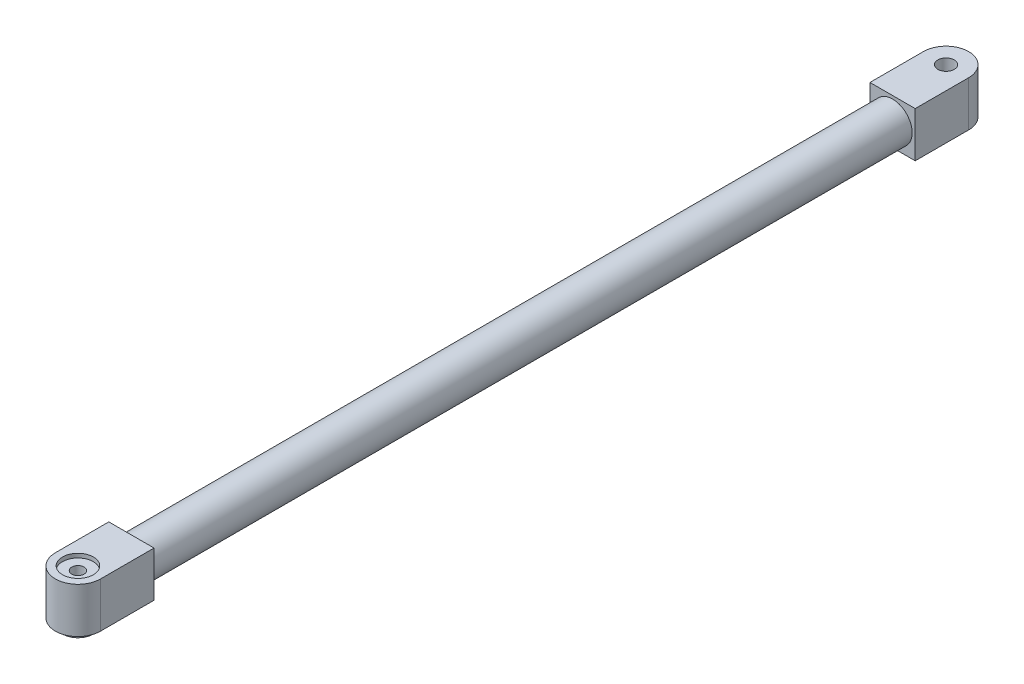
from build123d import *

# Parameters (mm, degrees)
SKETCH1_R                = 9.525
SKETCH1_R_2              = 6.2738
BOSS_EXTRUDE1_DEPTH      = 400
SKETCH2_W                = 22
SKETCH2_H                = 22
SKETCH2_R                = 9.525
BOSS_EXTRUDE2_DEPTH      = 15
SKETCH2_2_W              = 22
SKETCH2_2_H              = 22
BOSS_EXTRUDE3_DEPTH      = 2
SKETCH3_R                = 4
BOSS_EXTRUDE4_DEPTH      = 22
SKETCH4_R                = 7.5
CUT_EXTRUDE1_DEPTH       = 22
BOSS_EXTRUDE5_DEPTH      = 3
BOSS_EXTRUDE5_DEPTH_BACK = 20
SKETCH6_R                = 7.5
SKETCH8_R                = 3
CUT_EXTRUDE2_DEPTH       = 23


with BuildPart() as part:
    # Sketch1 → Boss-Extrude1 (new body)
    with BuildSketch(Plane.XY):
        Circle(SKETCH1_R)
        Circle(SKETCH1_R_2, mode=Mode.SUBTRACT)
    extrude(amount=BOSS_EXTRUDE1_DEPTH)


with BuildPart() as body_2:
    # Sketch2 → Boss-Extrude2 (new body)
    with BuildSketch(Plane(origin=(0, 0, 0), x_dir=(-1, 0, 0), z_dir=(0, 0, -1))):
        Rectangle(SKETCH2_W, SKETCH2_H)
        with Locations(Location((0, 0, 0), (0, 0, 180))):
            Circle(SKETCH2_R, mode=Mode.SUBTRACT)
    extrude(amount=-BOSS_EXTRUDE2_DEPTH)


with BuildPart() as body_3:
    # Sketch2<2> → Boss-Extrude3 (new body)
    with BuildSketch(Plane(origin=(0, 0, 0), x_dir=(-1, 0, 0), z_dir=(0, 0, -1))):
        Rectangle(SKETCH2_2_W, SKETCH2_2_H)
    extrude(amount=BOSS_EXTRUDE3_DEPTH)


with BuildPart() as body_2_1:
    add(body_2.part)

    # Combine1: union body 3
    add(body_3.part)

    # Sketch3 → Boss-Extrude4 (add)
    with BuildSketch(Plane.XZ.offset(11)):
        with BuildLine():
            Line((11, -2), (11, -11))
            ThreePointArc((11, -11), (0, -22), (-11, -11))
            Line((-11, -11), (-11, -2))
            Line((-11, -2), (11, -2))
        make_face()
        with Locations(Location((0, -11, 0), (0, 0, 270))):
            Circle(SKETCH3_R, mode=Mode.SUBTRACT)
    extrude(amount=-BOSS_EXTRUDE4_DEPTH)


with BuildPart() as body_3_2:
    # Mirror7: mirrored copy
    add(body_2_1.part.mirror(Plane(origin=(0, 0, 200), x_dir=(1, 0, 0), z_dir=(0, 0, -1))))

    # Sketch4 → Cut-Extrude1 (cut)
    with BuildSketch(Plane.XZ.offset(11)):
        with Locations(Location((0, 411, 0), (0, 0, 270))):
            Circle(SKETCH4_R)
    extrude(amount=-CUT_EXTRUDE1_DEPTH, mode=Mode.SUBTRACT)


with BuildPart() as body_4:
    # Sketch6 → Boss-Extrude5 (new, two sides: drawn at the far end of the back side and taken through both)
    with BuildSketch(Plane.XZ.offset(11).offset(-BOSS_EXTRUDE5_DEPTH_BACK)):
        with Locations(Location((0, 411, 0), (0, 0, 270))):
            Circle(SKETCH6_R)
    extrude(amount=BOSS_EXTRUDE5_DEPTH + BOSS_EXTRUDE5_DEPTH_BACK)

    # Sketch8 → Cut-Extrude2 (cut)
    with BuildSketch(Plane.XZ.offset(14)):
        with Locations(Location((0, 411, 0), (0, 0, 270))):
            Circle(SKETCH8_R)
    extrude(amount=-CUT_EXTRUDE2_DEPTH, mode=Mode.SUBTRACT)


solid = Compound([part.part, body_2_1.part, body_3_2.part, body_4.part])
